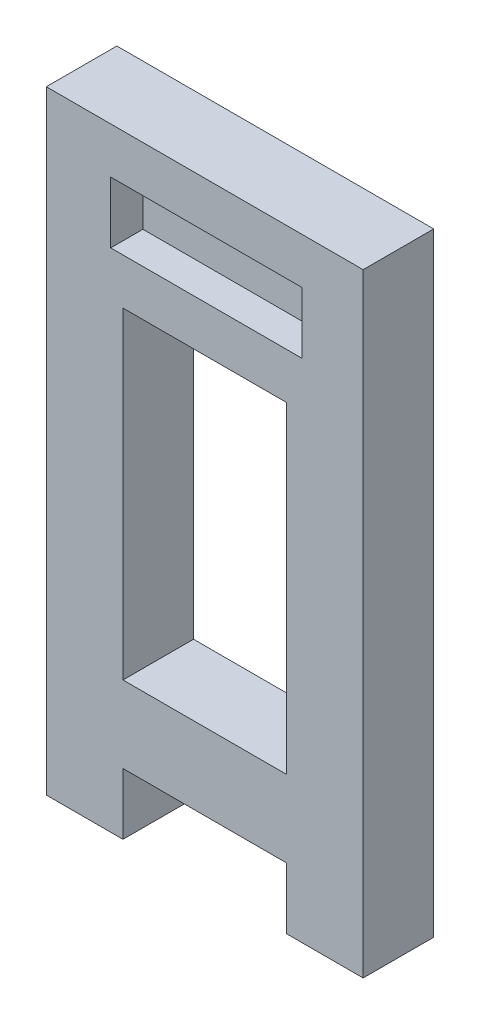
from build123d import *

# Parameters (mm, degrees)
SKETCH1_W           = 5.33
SKETCH1_H           = 10.5
SKETCH1_W_2         = 6.23
SKETCH1_H_2         = 2
BOSS_EXTRUDE1_DEPTH = 2.3
SKETCH1_2_W         = 6.23
SKETCH1_2_H         = 2
BOSS_EXTRUDE2_DEPTH = 1.25


with BuildPart() as part:
    # Sketch1 → Boss-Extrude1 (new body)
    with BuildSketch(Plane.XY):
        Polygon((0, 0), (0, -2), (2.5, -2), (2.5, 0), (7.83, 0), (7.83, -2), (10.33, -2), (10.33, 0), (10.33, 18), (0, 18), align=None)
        with Locations((5.165, 7.75)):
            Rectangle(SKETCH1_W, SKETCH1_H, mode=Mode.SUBTRACT)
        with Locations((5.215, 15.5)):
            Rectangle(SKETCH1_W_2, SKETCH1_H_2, mode=Mode.SUBTRACT)
    extrude(amount=BOSS_EXTRUDE1_DEPTH)

    # Sketch1<2> → Boss-Extrude2 (add)
    with BuildSketch(Plane.XY):
        with Locations((5.215, 15.5)):
            Rectangle(SKETCH1_2_W, SKETCH1_2_H)
    extrude(amount=BOSS_EXTRUDE2_DEPTH)


solid = part.part
